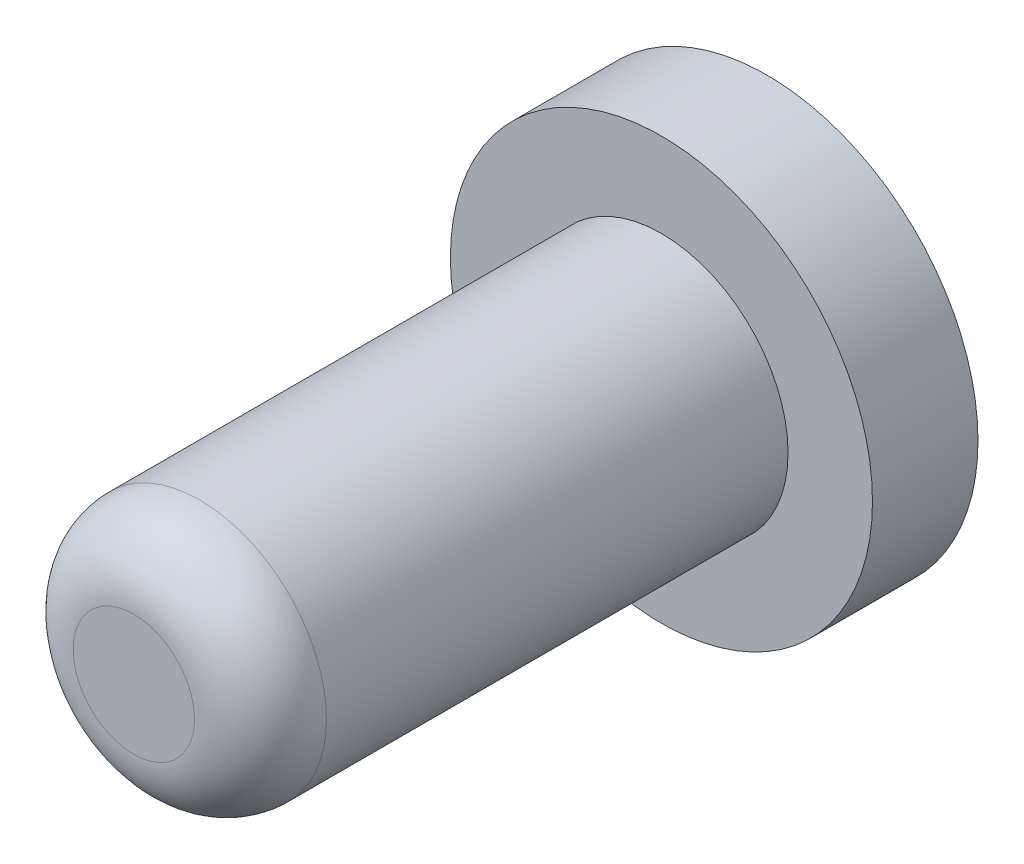
from build123d import *

# Parameters (mm, degrees)
BASE_SKETCH_R      = 4
BASE_EXTRUDE_DEPTH = 2
SKETCH2_R          = 2.4
TOP_EXTRUDE_DEPTH  = 10
TOP_FILLET_R       = 1.25


with BuildPart() as part:
    # Base Sketch → Base Extrude (new body)
    with BuildSketch(Plane.XY):
        Circle(BASE_SKETCH_R)
    extrude(amount=-BASE_EXTRUDE_DEPTH)

    # Sketch2 → Top Extrude (add)
    with BuildSketch(Plane.XY):
        Circle(SKETCH2_R)
    extrude(amount=TOP_EXTRUDE_DEPTH)

    # Top Fillet
    top_fillet_edges = [part.edges().sort_by_distance(p)[0] for p in [
        (-2.4, 0, 10),
    ]]
    fillet(top_fillet_edges, radius=TOP_FILLET_R)


solid = part.part
